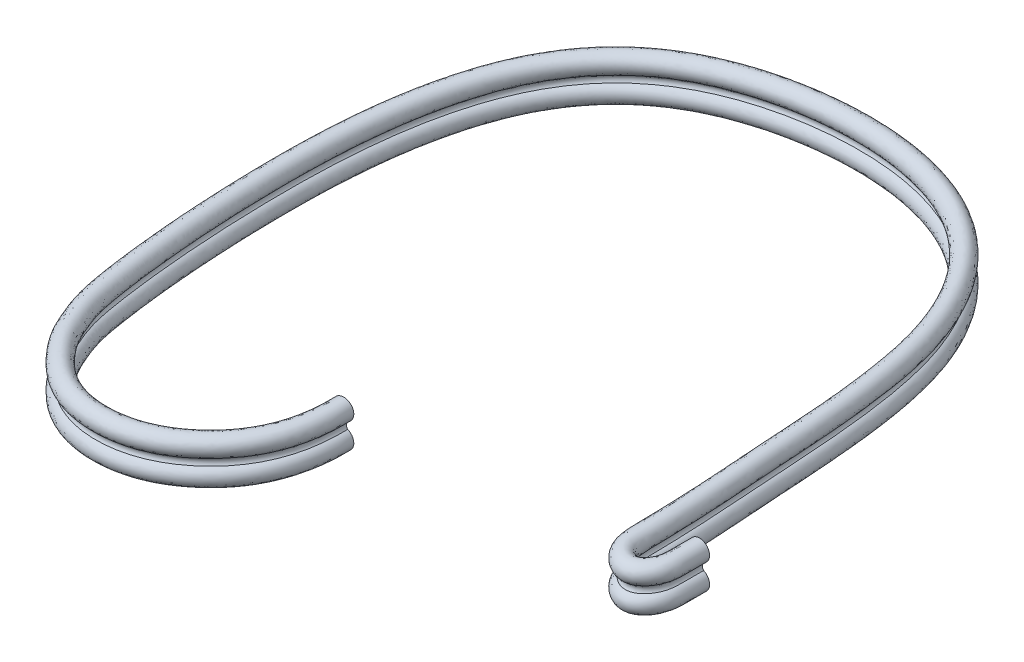
from build123d import *


with BuildPart() as part:
    # Balayage4: sweep along a path in Esquisse2
    with BuildLine() as balayage4_path:  # in the path sketch's own coordinates; laid on its plane below (add() does not lay a ready-made edge on the line's plane)
        add(Edge.make_bspline(
            [(18.213191843, 0), (18.213102854, 0.269031751), (18.212953449, 0.720711351), (18.213897675, 1.491771935), (18.844481615, 2.326554788), (19.780156902, 1.637205348), (19.806243904, -1.384055535), (20.062971718, -4.150682824), (20.479525442, -12.643531175), (25.265867941, -18.319085412), (35.657401697, -17.568780596), (39.468834802, -11.521160312), (39.642908636, -2.674014263), (39.003528602, 3.110696526), (38.664869352, 4.111771753), (37.873146909, 5.856850976), (35.689035987, 7.729506681), (31.940484231, 7.169030668), (30.063155229, 4.249272607), (30.125555744, 2.215342288)],
            knots=[0, 0, 0, 0, 0.011018692, 0.018499372, 0.028962669, 0.039203292, 0.045972456, 0.095547429, 0.150587074, 0.211468277, 0.306348681, 0.412437696, 0.520673344, 0.63816137, 0.783374729, 0.855606711, 0.914095314, 0.963999219, 1, 1, 1, 1], degree=3))
    # Esquisse1 → Balayage4 (sweep)
    with BuildSketch(Plane.XY):
        with BuildLine():
            ThreePointArc((-18.377490277, -10.30099939), (-18.213191843, -11.0656993), (-18.04889341, -10.30099939))
            ThreePointArc((-18.04889341, -10.30099939), (-18.100036633, -10.1656993), (-18.04889341, -10.030399211))
            ThreePointArc((-18.04889341, -10.030399211), (-18.213191843, -9.2656993), (-18.377490277, -10.030399211))
            ThreePointArc((-18.377490277, -10.030399211), (-18.326347054, -10.1656993), (-18.377490277, -10.30099939))
        make_face()
    sweep(path=Plane(origin=(0, -10.1656993, 0), x_dir=(-1, 0, 0), z_dir=(0, 1, 0)) * balayage4_path.line)


solid = part.part
